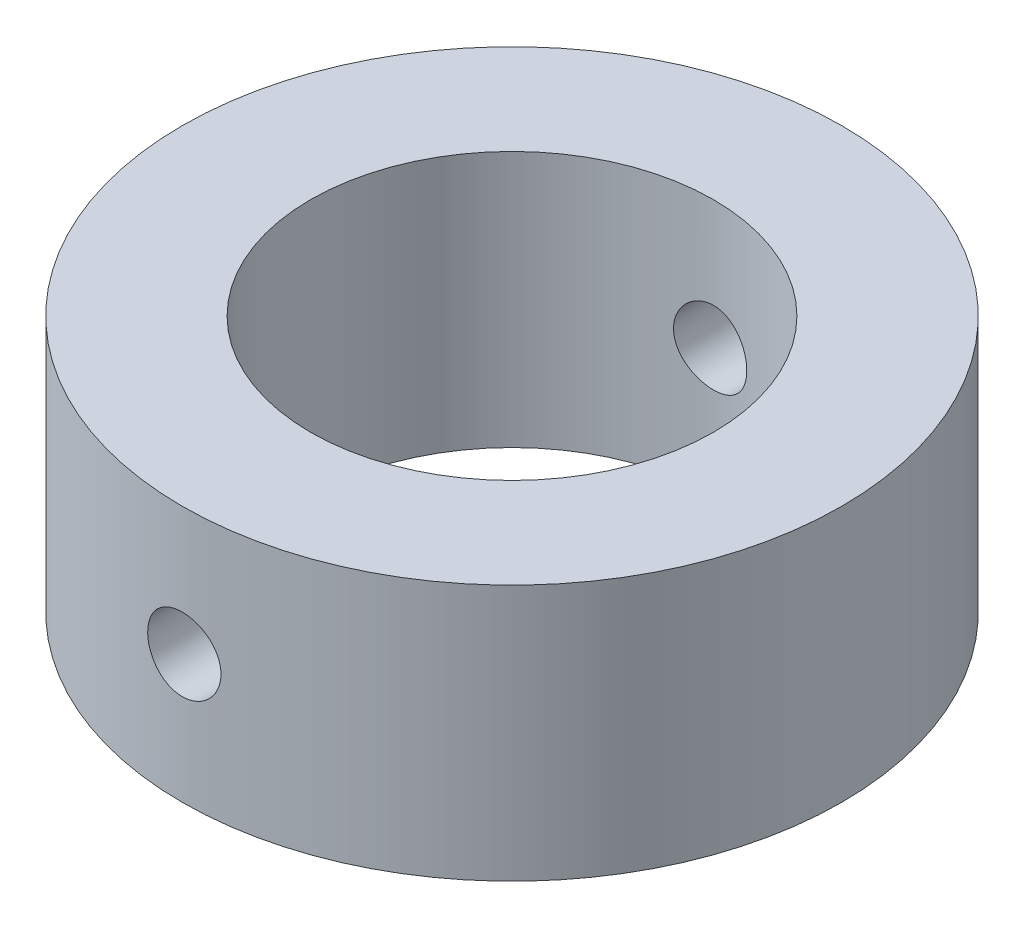
from build123d import *

# Parameters (mm, degrees)
SKETCH1_W               = 7
SKETCH1_H               = 14
CUT_EXTRUDE1_DEPTH      = 25
CUT_EXTRUDE1_DEPTH_BACK = 26
SKETCH2_R               = 2


with BuildPart() as part:
    # Sketch1 → Revolve1 (revolve)
    with BuildSketch(Plane.XY, mode=Mode.PRIVATE) as revolve1_sk:
        with Locations((14.5, 0)):
            Rectangle(SKETCH1_W, SKETCH1_H)
    revolve(revolve1_sk.sketch.rotate(Axis((0, -7.728, 0), (0, 1, 0)), 90), axis=Axis((0, -7.728, 0), (0, 1, 0)))

    # Sketch2 → Cut-Extrude1 (cut, two sides: drawn at the far end of the back side and taken through both)
    with BuildSketch(Plane.XY.offset(-CUT_EXTRUDE1_DEPTH_BACK)):
        Circle(SKETCH2_R)
    extrude(amount=CUT_EXTRUDE1_DEPTH + CUT_EXTRUDE1_DEPTH_BACK, mode=Mode.SUBTRACT)


solid = part.part
